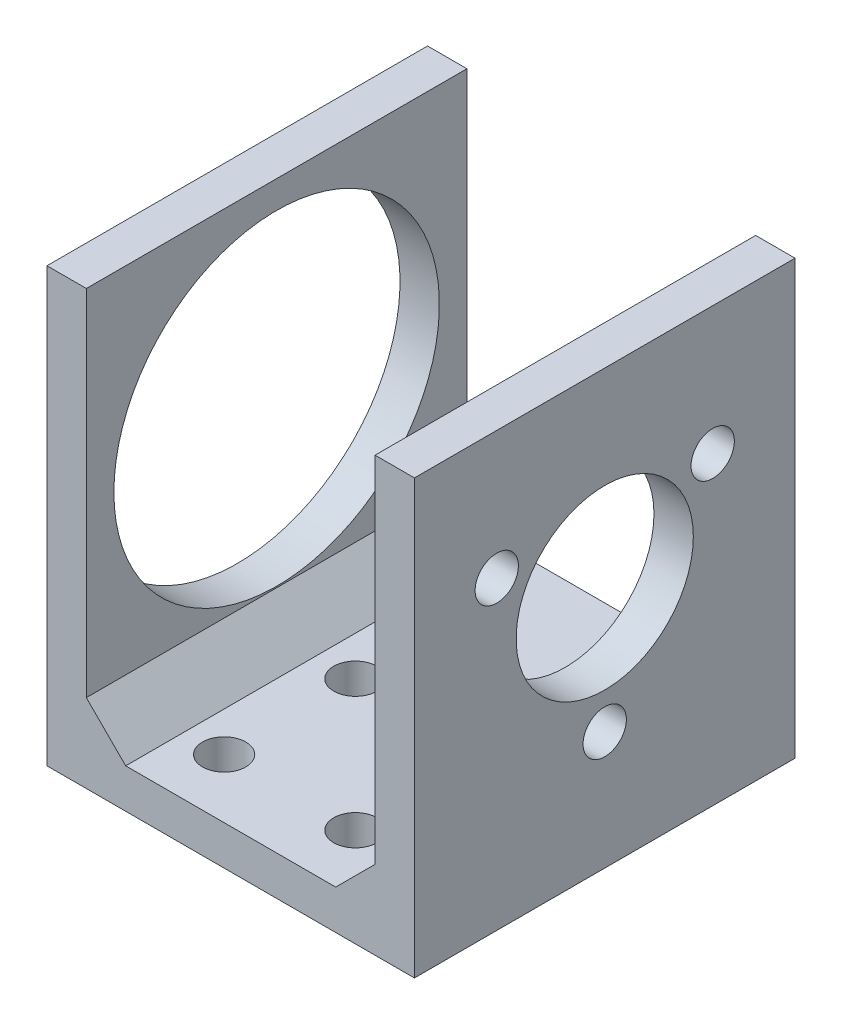
from build123d import *

# Parameters (mm, degrees)
SKETCH_1_W          = 28
SKETCH_1_H          = 29
EXTRUDE_1_DEPTH     = 3
SKETCH_2_W          = 3
SKETCH_2_H          = 29
EXTRUDE_2_DEPTH     = 30
SKETCH_3_R          = 1.65
CUT_EXTRUDE_1_DEPTH = 33
EXTRUDE_3_DEPTH     = 29
SKETCH_6_R          = 12.4
CUT_EXTRUDE_2_DEPTH = 5
SKETCH_8_R          = 1.65
CUT_EXTRUDE_3_DEPTH = 5
SKETCH_9_R          = 6.75
CUT_EXTRUDE_4_DEPTH = 5


with BuildPart() as part:
    # 草图1 → 凸台-拉伸1 (new body)
    with BuildSketch(Plane(origin=(0, 0, 0), x_dir=(1, 0, 0), z_dir=(0, 1, 0))):
        Rectangle(SKETCH_1_W, SKETCH_1_H)
    extrude(amount=EXTRUDE_1_DEPTH)

    # 草图2 → 凸台-拉伸2 (add)
    with BuildSketch(Plane(origin=(0, 3, 0), x_dir=(1, 0, 0), z_dir=(0, 1, 0))):
        with Locations((12.5, 0)):
            Rectangle(SKETCH_2_W, SKETCH_2_H)
        with Locations((-12.5, 0)):
            Rectangle(SKETCH_2_W, SKETCH_2_H)
    extrude(amount=EXTRUDE_2_DEPTH)

    # 草图3 → 切除-拉伸1 (cut)
    with BuildSketch(Plane.ZY.offset(14)):
        with Locations((-8.227241336, 23.25)):
            Circle(SKETCH_3_R)
        with Locations((8.227241336, 23.25)):
            Circle(SKETCH_3_R)
        with Locations((0, 9)):
            Circle(SKETCH_3_R)
    extrude(amount=-CUT_EXTRUDE_1_DEPTH, mode=Mode.SUBTRACT)

    # 草图5 → 凸台-拉伸3 (add)
    with BuildSketch(Plane(origin=(0, 0, -14.5), x_dir=(-1, 0, 0), z_dir=(0, 0, -1))):
        Polygon((11, 3), (11, 6), (8, 3), align=None)
        Polygon((-11, 3), (-11, 6), (-8, 3), align=None)
    extrude(amount=-EXTRUDE_3_DEPTH)

    # 草图6 → 切除-拉伸2 (cut)
    with BuildSketch(Plane.ZY.offset(14)):
        with Locations((0, 18.5)):
            Circle(SKETCH_6_R)
    extrude(amount=-CUT_EXTRUDE_2_DEPTH, mode=Mode.SUBTRACT)

    # 草图8 → 切除-拉伸3 (cut)
    with BuildSketch(Plane(origin=(0, 3, 0), x_dir=(1, 0, 0), z_dir=(0, 1, 0))):
        with BuildLine():
            ThreePointArc((-3.35, 10), (-6.166726189, 11.166726189), (-5, 8.35))
            Line((-5, 8.35), (-5, 10))
            Line((-5, 10), (-3.35, 10))
        make_face()
        with BuildLine():
            Line((-5, 10), (-5, 8.35))
            ThreePointArc((-5, 8.35), (-3.833273811, 8.833273811), (-3.35, 10))
            Line((-3.35, 10), (-5, 10))
        make_face()
        with BuildLine():
            ThreePointArc((3.35, 10), (3.833273811, 8.833273811), (5, 8.35))
            Line((5, 8.35), (5, 10))
            Line((5, 10), (3.35, 10))
        make_face()
        with BuildLine():
            Line((5, 10), (5, 8.35))
            ThreePointArc((5, 8.35), (6.166726189, 8.833273811), (6.65, 10))
            ThreePointArc((6.65, 10), (5, 11.65), (3.35, 10))
            Line((3.35, 10), (5, 10))
        make_face()
        with BuildLine():
            ThreePointArc((5, -8.35), (3.833273811, -8.833273811), (3.35, -10))
            Line((3.35, -10), (5, -10))
            Line((5, -10), (5, -8.35))
        make_face()
        with BuildLine():
            Line((5, -10), (3.35, -10))
            ThreePointArc((3.35, -10), (5, -11.65), (6.65, -10))
            ThreePointArc((6.65, -10), (6.166726189, -8.833273811), (5, -8.35))
            Line((5, -8.35), (5, -10))
        make_face()
        with BuildLine():
            Line((-5, -8.35), (-5, -10))
            Line((-5, -10), (-3.35, -10))
            ThreePointArc((-3.35, -10), (-3.833273811, -8.833273811), (-5, -8.35))
        make_face()
        with BuildLine():
            Line((-3.35, -10), (-5, -10))
            Line((-5, -10), (-5, -8.35))
            ThreePointArc((-5, -8.35), (-6.166726189, -11.166726189), (-3.35, -10))
        make_face()
        with Locations(Location((5, 0, 0), (0, 0, 270))):
            Circle(SKETCH_8_R)
        with Locations(Location((-5, 0, 0), (0, 0, 270))):
            Circle(SKETCH_8_R)
    extrude(amount=-CUT_EXTRUDE_3_DEPTH, mode=Mode.SUBTRACT)

    # 草图9 → 切除-拉伸4 (cut)
    with BuildSketch(Plane(origin=(14, 0, 0), x_dir=(0, 0, -1), z_dir=(1, 0, 0))):
        with Locations((0, 18.5)):
            Circle(SKETCH_9_R)
    extrude(amount=-CUT_EXTRUDE_4_DEPTH, mode=Mode.SUBTRACT)


solid = part.part
